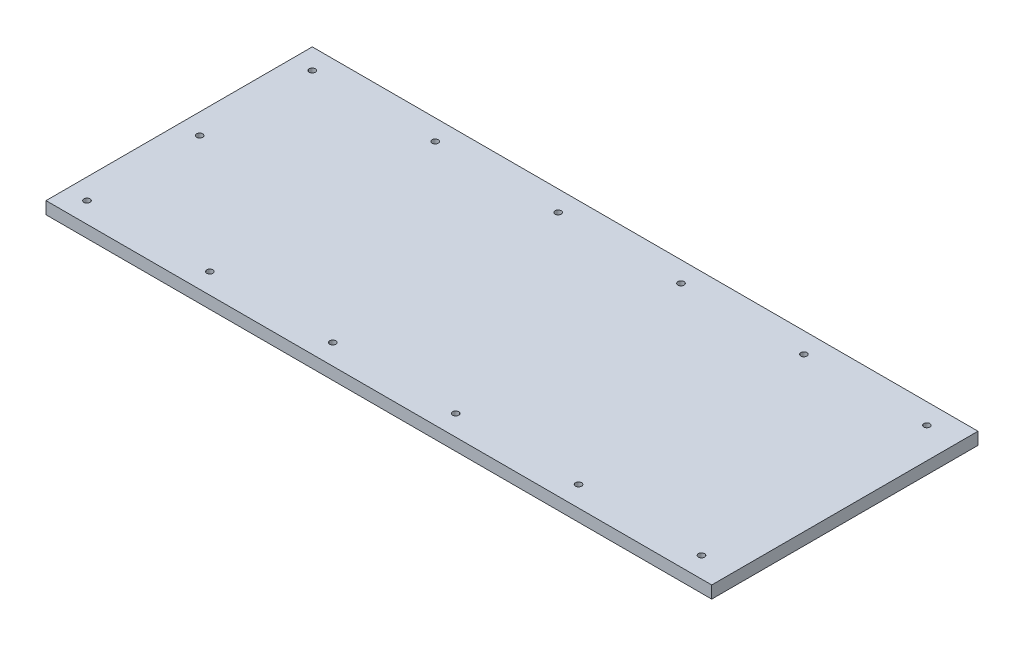
from build123d import *

# Parameters (mm, degrees)
SKETCH_1_W      = 325
SKETCH_1_H      = 130
SKETCH_1_R      = 1.5
EXTRUDE_1_DEPTH = 6


with BuildPart() as part:
    # 草图1 → 凸台-拉伸1 (new body)
    with BuildSketch(Plane(origin=(0, 0, 0), x_dir=(1, 0, 0), z_dir=(0, 1, 0))):
        Rectangle(SKETCH_1_W, SKETCH_1_H)
        with Locations(Location((-152.5, 55, 0), (0, 0, 270))):
            Circle(SKETCH_1_R, mode=Mode.SUBTRACT)
        with Locations(Location((-152.5, -55, 0), (0, 0, 270))):
            Circle(SKETCH_1_R, mode=Mode.SUBTRACT)
        with Locations(Location((-92.5, 55, 0), (0, 0, 270))):
            Circle(SKETCH_1_R, mode=Mode.SUBTRACT)
        with Locations(Location((-32.5, 55, 0), (0, 0, 270))):
            Circle(SKETCH_1_R, mode=Mode.SUBTRACT)
        with Locations(Location((27.5, 55, 0), (0, 0, 270))):
            Circle(SKETCH_1_R, mode=Mode.SUBTRACT)
        with Locations(Location((87.5, 55, 0), (0, 0, 270))):
            Circle(SKETCH_1_R, mode=Mode.SUBTRACT)
        with Locations(Location((147.5, 55, 0), (0, 0, 270))):
            Circle(SKETCH_1_R, mode=Mode.SUBTRACT)
        with Locations(Location((-92.5, -55, 0), (0, 0, 270))):
            Circle(SKETCH_1_R, mode=Mode.SUBTRACT)
        with Locations(Location((-32.5, -55, 0), (0, 0, 270))):
            Circle(SKETCH_1_R, mode=Mode.SUBTRACT)
        with Locations(Location((27.5, -55, 0), (0, 0, 270))):
            Circle(SKETCH_1_R, mode=Mode.SUBTRACT)
        with Locations(Location((87.5, -55, 0), (0, 0, 270))):
            Circle(SKETCH_1_R, mode=Mode.SUBTRACT)
        with Locations(Location((147.5, -55, 0), (0, 0, 270))):
            Circle(SKETCH_1_R, mode=Mode.SUBTRACT)
        with Locations(Location((-152.5, 0, 0), (0, 0, 270))):
            Circle(SKETCH_1_R, mode=Mode.SUBTRACT)
    extrude(amount=EXTRUDE_1_DEPTH)


solid = part.part
